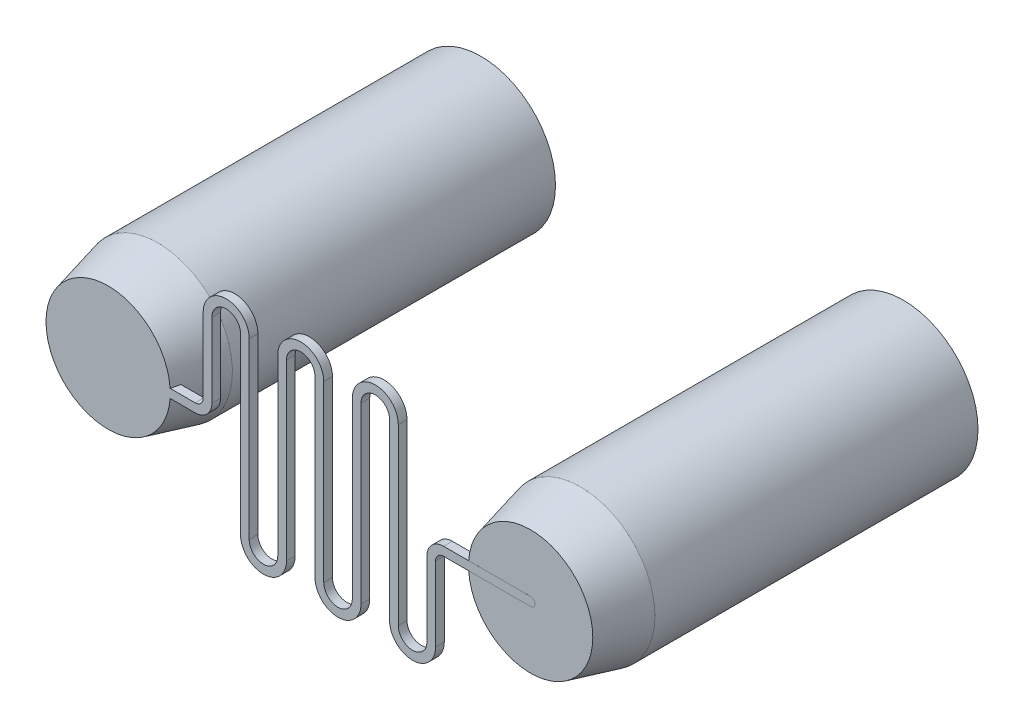
from build123d import *

# Parameters (mm, degrees)
BOSS_EXTRUDE1_DEPTH = 0.7
SKETCH5_R           = 5
CUT_EXTRUDE1_DEPTH  = 27
SKETCH6_R           = 5
CUT_EXTRUDE2_DEPTH  = 27


with BuildPart() as part:
    # Sketch2 → Boss-Extrude1 (new body)
    with BuildSketch(Plane.XY):
        with BuildLine():
            Line((-20.5, -0.35), (-13.5, -0.35))
            ThreePointArc((-13.5, -0.35), (-12.545405845, 0.045405845), (-12.15, 1))
            Line((-12.15, 1), (-12.15, 7))
            ThreePointArc((-12.15, 7), (-11, 8.15), (-9.85, 7))
            Line((-9.85, 7), (-9.85, 0))
            Line((-9.85, 0), (-9.85, -7))
            ThreePointArc((-9.85, -7), (-8, -8.85), (-6.15, -7))
            Line((-6.15, -7), (-6.15, 0))
            Line((-6.15, 0), (-6.15, 7))
            ThreePointArc((-6.15, 7), (-5, 8.15), (-3.85, 7))
            Line((-3.85, 7), (-3.85, 0))
            Line((-3.85, 0), (-3.85, -7))
            ThreePointArc((-3.85, -7), (-2, -8.85), (-0.15, -7))
            Line((-0.15, -7), (-0.15, 0))
            Line((-0.15, 0), (-0.15, 7))
            ThreePointArc((-0.15, 7), (1, 8.15), (2.15, 7))
            Line((2.15, 7), (2.15, 0))
            Line((2.15, 0), (2.15, -7))
            ThreePointArc((2.15, -7), (4, -8.85), (5.85, -7))
            Line((5.85, -7), (5.85, -1))
            ThreePointArc((5.85, -1), (6.040380592, -0.540380592), (6.5, -0.35))
            Line((6.5, -0.35), (13.5, -0.35))
            ThreePointArc((13.5, -0.35), (13.85, 0), (13.5, 0.35))
            Line((13.5, 0.35), (6.5, 0.35))
            ThreePointArc((6.5, 0.35), (5.545405845, -0.045405845), (5.15, -1))
            Line((5.15, -1), (5.15, -7))
            ThreePointArc((5.15, -7), (4, -8.15), (2.85, -7))
            Line((2.85, -7), (2.85, 0))
            Line((2.85, 0), (2.85, 7))
            ThreePointArc((2.85, 7), (1, 8.85), (-0.85, 7))
            Line((-0.85, 7), (-0.85, 0))
            Line((-0.85, 0), (-0.85, -7))
            ThreePointArc((-0.85, -7), (-2, -8.15), (-3.15, -7))
            Line((-3.15, -7), (-3.15, 0))
            Line((-3.15, 0), (-3.15, 7))
            ThreePointArc((-3.15, 7), (-5, 8.85), (-6.85, 7))
            Line((-6.85, 7), (-6.85, 0))
            Line((-6.85, 0), (-6.85, -7))
            ThreePointArc((-6.85, -7), (-8, -8.15), (-9.15, -7))
            Line((-9.15, -7), (-9.15, 0))
            Line((-9.15, 0), (-9.15, 7))
            ThreePointArc((-9.15, 7), (-11, 8.85), (-12.85, 7))
            Line((-12.85, 7), (-12.85, 1))
            ThreePointArc((-12.85, 1), (-13.040380592, 0.540380592), (-13.5, 0.35))
            Line((-13.5, 0.35), (-20.5, 0.35))
            ThreePointArc((-20.5, 0.35), (-20.85, 0), (-20.5, -0.35))
        make_face()
    extrude(amount=BOSS_EXTRUDE1_DEPTH)

    # Sketch3 → Revolve1 (revolve)
    with BuildSketch(Plane(origin=(0, 0, 0), x_dir=(1, 0, 0), z_dir=(0, 1, 0)), mode=Mode.PRIVATE) as revolve1_sk:
        Polygon((-20.5, -0.7), (-25.5, -0.7), (-26.5, 3.3), (-26.5, 29.3), (-20.5, 29.3), align=None)
    revolve(revolve1_sk.sketch.rotate(Axis((-20.5, 0, 0.7), (0, 0, -1)), 175.986012782), axis=Axis((-20.5, 0, 0.7), (0, 0, -1)))

    # Sketch4 → Revolve2 (revolve)
    with BuildSketch(Plane(origin=(0, 0, 0), x_dir=(1, 0, 0), z_dir=(0, 1, 0)), mode=Mode.PRIVATE) as revolve2_sk:
        Polygon((13.5, -0.69956823), (18.5, -0.69956823), (19.5, 3.30043177), (19.5, 29.30043177), (13.5, 29.30043177), align=None)
    revolve(revolve2_sk.sketch.rotate(Axis((13.5, 0, 0.69956823), (0, 0, -1)), 176.121883858), axis=Axis((13.5, 0, 0.69956823), (0, 0, -1)))

    # Sketch5 → Cut-Extrude1 (cut)
    with BuildSketch(Plane(origin=(0, 0, -29.3), x_dir=(-1, 0, 0), z_dir=(0, 0, -1))):
        with Locations((-13.5, 0)):
            Circle(SKETCH5_R)
        with Locations((20.5, 0)):
            Circle(SKETCH5_R)
    extrude(amount=-CUT_EXTRUDE1_DEPTH, mode=Mode.SUBTRACT)

    # Sketch6 → Cut-Extrude2 (cut)
    with BuildSketch(Plane(origin=(0, 0, -29.30043177), x_dir=(-1, 0, 0), z_dir=(0, 0, -1))):
        with Locations((-13.5, 0)):
            Circle(SKETCH6_R)
    extrude(amount=-CUT_EXTRUDE2_DEPTH, mode=Mode.SUBTRACT)


solid = part.part
